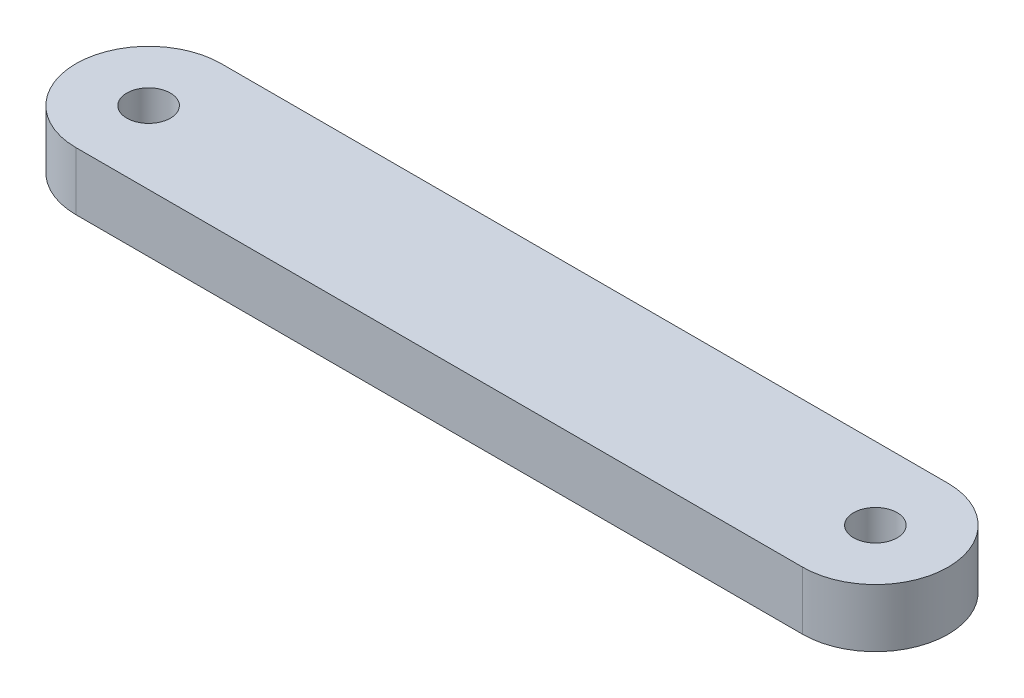
from build123d import *

# Parameters (mm, degrees)
SKETCH_1_R      = 1.5
EXTRUDE_1_DEPTH = 4


with BuildPart() as part:
    # 草图1 → 凸台-拉伸1 (new body)
    with BuildSketch(Plane(origin=(0, 0, 0), x_dir=(1, 0, 0), z_dir=(0, 1, 0))):
        with BuildLine():
            Line((-26.252408478, 5), (23.747591522, 5))
            ThreePointArc((23.747591522, 5), (28.747591522, 0), (23.747591522, -5))
            Line((23.747591522, -5), (-26.252408478, -5))
            ThreePointArc((-26.252408478, -5), (-31.252408478, 0), (-26.252408478, 5))
        make_face()
        with Locations(Location((-26.252408478, 0, 0), (0, 0, 270))):
            Circle(SKETCH_1_R, mode=Mode.SUBTRACT)
        with Locations(Location((23.747591522, 0, 0), (0, 0, 270))):
            Circle(SKETCH_1_R, mode=Mode.SUBTRACT)
    extrude(amount=EXTRUDE_1_DEPTH)


solid = part.part
